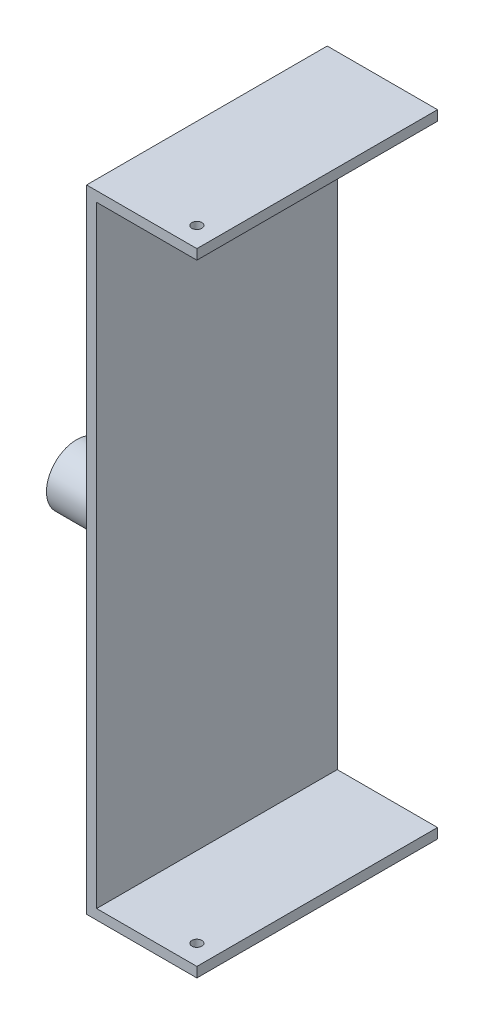
from build123d import *

# Parameters (mm, degrees)
BOSS_EXTRUDE1_DEPTH = 120
SKETCH2_R           = 15
BOSS_EXTRUDE2_DEPTH = 35
SKETCH3_R           = 2.5
CUT_EXTRUDE1_DEPTH  = 320


with BuildPart() as part:
    # Sketch1 → Boss-Extrude1 (new body)
    with BuildSketch(Plane.XY):
        Polygon((-5, 5), (50, 5), (50, 0), (0, 0), (0, -305), (50, -305), (50, -310), (-5, -310), align=None)
    extrude(amount=BOSS_EXTRUDE1_DEPTH)

    # Sketch2 → Boss-Extrude2 (add)
    with BuildSketch(Plane.ZY.offset(5)):
        with Locations(Location((90, -152.5, 0), (0, 0, 90))):
            Circle(SKETCH2_R)
    extrude(amount=BOSS_EXTRUDE2_DEPTH)

    # Sketch3 → Cut-Extrude1 (cut)
    with BuildSketch(Plane.XZ.offset(310)):
        with Locations(Location((40, 110, 0), (0, 0, 270))):
            Circle(SKETCH3_R)
    extrude(amount=-CUT_EXTRUDE1_DEPTH, mode=Mode.SUBTRACT)


solid = part.part
